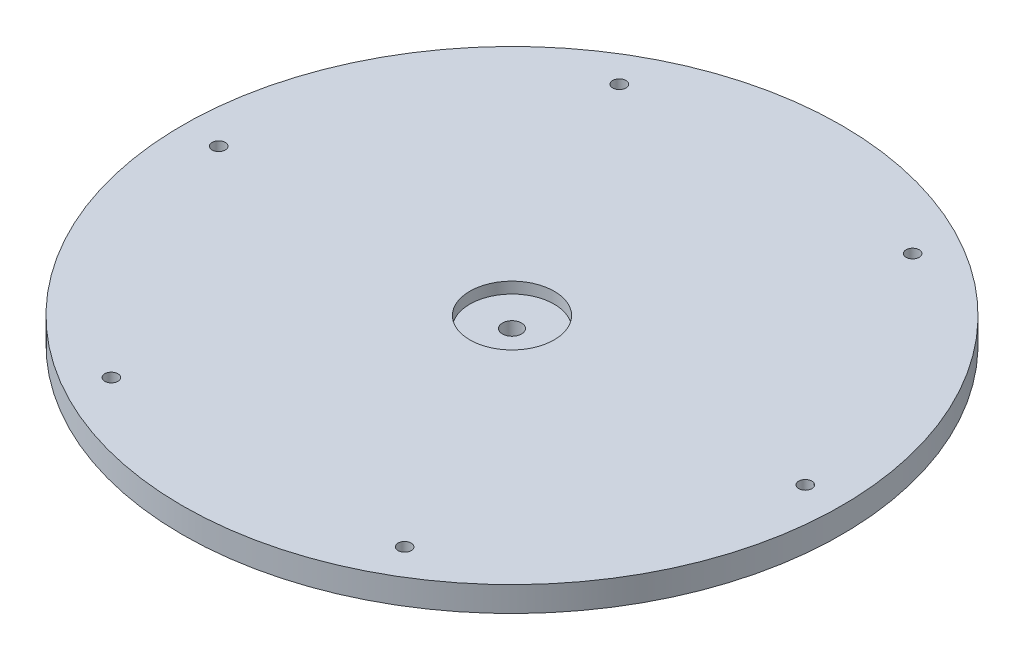
from build123d import *

# Parameters (mm, degrees)
SKETCH1_R           = 250
SKETCH1_R_2         = 7.25
BOSS_EXTRUDE1_DEPTH = 9.5
SKETCH2_R           = 32
CUT_EXTRUDE1_DEPTH  = 8.5
SKETCH3_R           = 5
CUT_EXTRUDE2_DEPTH  = 355.063553617


with BuildPart() as part:
    # Sketch1 → Boss-Extrude1 (new, symmetric)
    with BuildSketch(Plane(origin=(0, 0, 0), x_dir=(1, 0, 0), z_dir=(0, 1, 0))):
        with Locations(Location((0, 0, 0), (0, 0, 270))):
            Circle(SKETCH1_R)
        with Locations(Location((0, 0, 0), (0, 0, 270))):
            Circle(SKETCH1_R_2, mode=Mode.SUBTRACT)
    extrude(amount=BOSS_EXTRUDE1_DEPTH, both=True)

    # Sketch2 → Cut-Extrude1 (cut)
    with BuildSketch(Plane(origin=(0, 9.5, 0), x_dir=(1, 0, 0), z_dir=(0, 1, 0))):
        with Locations(Location((0, 0, 0), (0, 0, 270))):
            Circle(SKETCH2_R)
    extrude(amount=-CUT_EXTRUDE1_DEPTH, mode=Mode.SUBTRACT)

    # Sketch3 → Cut-Extrude2 (cut, through all)
    with BuildSketch(Plane.XZ.offset(9.5)):
        with Locations(Location((111.25, 192.690652342, 0), (0, 0, 270))):
            Circle(SKETCH3_R)
        with Locations(Location((222.5, 0, 0), (0, 0, 270))):
            Circle(SKETCH3_R)
        with Locations(Location((-111.25, -192.690652342, 0), (0, 0, 90))):
            Circle(SKETCH3_R)
        with Locations(Location((-222.5, 0, 0), (0, 0, 90))):
            Circle(SKETCH3_R)
        with Locations(Location((-111.25, 192.690652342, 0), (0, 0, 270))):
            Circle(SKETCH3_R)
        with Locations(Location((111.25, -192.690652342, 0), (0, 0, 270))):
            Circle(SKETCH3_R)
    extrude(amount=-CUT_EXTRUDE2_DEPTH, mode=Mode.SUBTRACT)


solid = part.part
